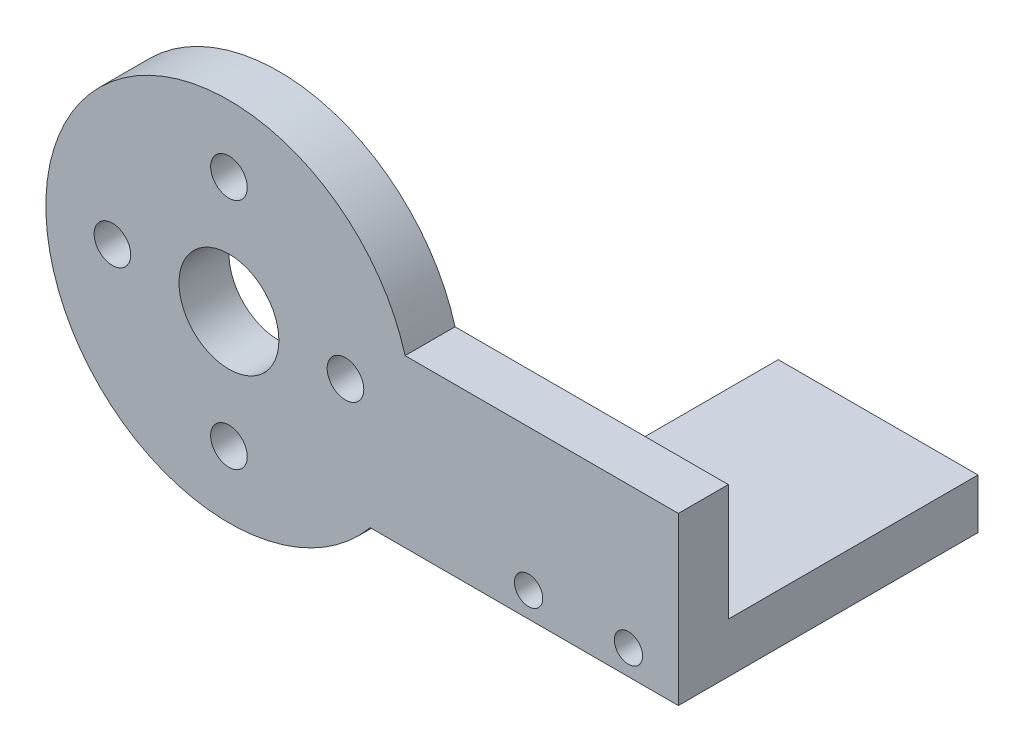
from build123d import *

# Parameters (mm, degrees)
STOCK_HORN_ATTACHMENT_START         = 15
STOCK_HORN_ATTACHMENT_PROFILE_R     = 11
STOCK_HORN_ATTACHMENT_DEPTH         = 3
FINGER_ARM_START                    = 15
FINGER_ARM_PROFILE_W                = 27
FINGER_ARM_PROFILE_H                = 10
FINGER_ARM_DEPTH                    = 3
DESCENDING_CONTACT_FINGER_PROFILE_W = 12
DESCENDING_CONTACT_FINGER_PROFILE_H = 3
DESCENDING_CONTACT_FINGER_DEPTH     = 18
HORN_CENTER_ACCESS_START            = -50
HORN_CENTER_ACCESS_PROFILE_R        = 3
HORN_CENTER_ACCESS_DEPTH            = 85.263683398
HORN_SCREWS_START                   = -50
HORN_SCREWS_PROFILE_R               = 1.1
HORN_SCREWS_DEPTH                   = 85.263683398
CONTACT_PAD_KEEPER_START            = -50
CONTACT_PAD_KEEPER_PROFILE_R        = 0.85
CONTACT_PAD_KEEPER_DEPTH            = 85.263683398


with BuildPart() as part:
    # Stock_horn_attachment_profile → Stock_horn_attachment (new body)
    with BuildSketch(Plane.XY.offset(STOCK_HORN_ATTACHMENT_START)):
        Circle(STOCK_HORN_ATTACHMENT_PROFILE_R)
    extrude(amount=STOCK_HORN_ATTACHMENT_DEPTH)

    # Finger_arm_profile → Finger_arm (add)
    with BuildSketch(Plane.XY.offset(FINGER_ARM_START)):
        with Locations((13.5, -2)):
            Rectangle(FINGER_ARM_PROFILE_W, FINGER_ARM_PROFILE_H)
    extrude(amount=FINGER_ARM_DEPTH)

    # Descending_contact_finger_profile → Descending_contact_finger (add)
    with BuildSketch(Plane.XY):
        with Locations((21, -5.5)):
            Rectangle(DESCENDING_CONTACT_FINGER_PROFILE_W, DESCENDING_CONTACT_FINGER_PROFILE_H)
    extrude(amount=DESCENDING_CONTACT_FINGER_DEPTH)

    # Horn_center_access_profile → Horn_center_access (cut, through all)
    with BuildSketch(Plane.XY.offset(HORN_CENTER_ACCESS_START)):
        Circle(HORN_CENTER_ACCESS_PROFILE_R)
    extrude(amount=HORN_CENTER_ACCESS_DEPTH, mode=Mode.SUBTRACT)

    # Horn_screws_profile → Horn_screws (cut, through all)
    with BuildSketch(Plane.XY.offset(HORN_SCREWS_START)):
        with Locations((0, -7)):
            Circle(HORN_SCREWS_PROFILE_R)
        with Locations((0, 7)):
            Circle(HORN_SCREWS_PROFILE_R)
        with Locations((-7, 0)):
            Circle(HORN_SCREWS_PROFILE_R)
        with Locations((7, 0)):
            Circle(HORN_SCREWS_PROFILE_R)
    extrude(amount=HORN_SCREWS_DEPTH, mode=Mode.SUBTRACT)

    # Contact_pad_keeper_profile → Contact_pad_keeper (cut, through all)
    with BuildSketch(Plane.XY.offset(CONTACT_PAD_KEEPER_START)):
        with Locations(Location((18, -5.5, 0), (0, 0, 180))):
            Circle(CONTACT_PAD_KEEPER_PROFILE_R)
        with Locations(Location((24, -5.5, 0), (0, 0, 180))):
            Circle(CONTACT_PAD_KEEPER_PROFILE_R)
    extrude(amount=CONTACT_PAD_KEEPER_DEPTH, mode=Mode.SUBTRACT)


solid = part.part
